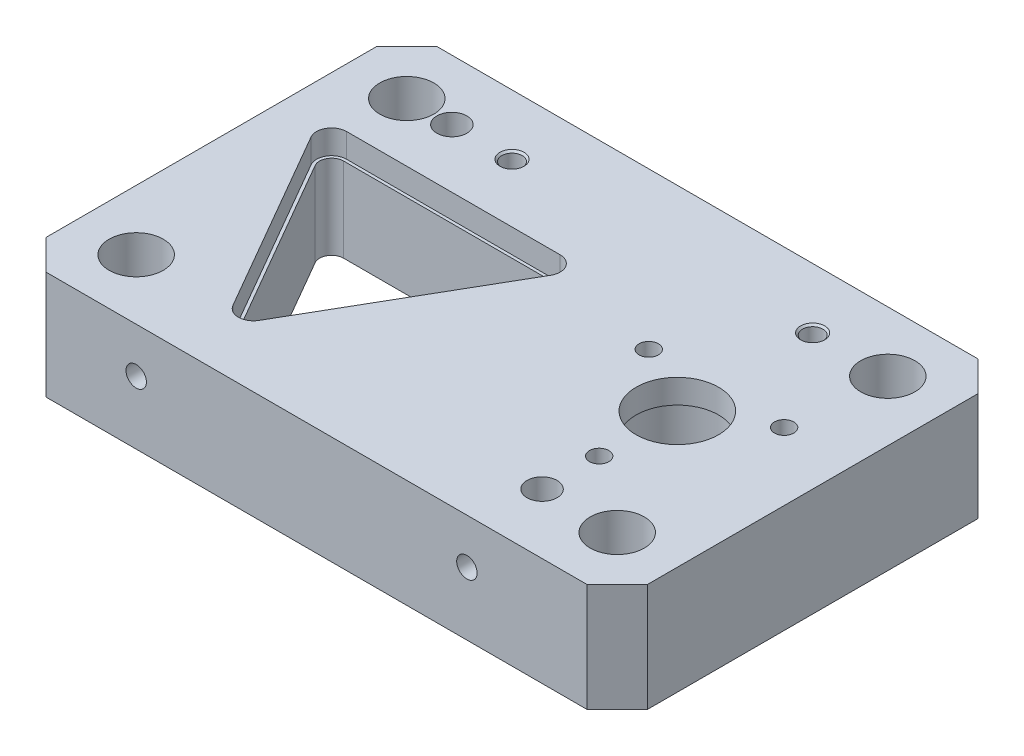
from build123d import *

# Parameters (mm, degrees)
SKETCH1_R                   = 5
SKETCH1_R_2                 = 5.5
SKETCH1_R_3                 = 3.22
SKETCH1_R_4                 = 13.72
BOSS_EXTRUDE1_DEPTH         = 36
M8_TAPPED_HOLE2_D           = 6.8
M8_TAPPED_HOLE2_CSINK_D     = 8.05
M8_TAPPED_HOLE2_CSINK_ANGLE = 90
CUT_EXTRUDE1_DEPTH          = 8
SKETCH1_4_R                 = 9
SKETCH1_4_R_2               = 5.5
CUT_EXTRUDE2_DEPTH          = 16
CUT_EXTRUDE3_START          = -8
SKETCH1_5_R                 = 14.5
SKETCH1_5_R_2               = 4
SKETCH1_5_R_3               = 3.22
CUT_EXTRUDE3_DEPTH          = 117.583305463
M8_TAPPED_HOLE1_D           = 6.8
M8_TAPPED_HOLE1_DEPTH       = 12.957073895
M8_TAPPED_HOLE1_TIP         = 2.042926105


with BuildPart() as part:
    # Sketch1 → Boss-Extrude1 (new body)
    with BuildSketch(Plane(origin=(0, 0, 0), x_dir=(1, 0, 0), z_dir=(0, 1, 0))):
        Polygon((90, -65), (100, -55), (100, 55), (90, 65), (-90, 65), (-100, 55), (-100, -55), (-90, -65), align=None)
        with Locations((55, -45)):
            Circle(SKETCH1_R, mode=Mode.SUBTRACT)
        with Locations((-65, 45)):
            Circle(SKETCH1_R, mode=Mode.SUBTRACT)
        with Locations((-80, -45)):
            Circle(SKETCH1_R_2, mode=Mode.SUBTRACT)
        with BuildLine():
            Line((-80.507041555, 24.5), (-9.492958445, 24.5))
            ThreePointArc((-9.492958445, 24.5), (-6.02885683, 22.5), (-6.02885683, 18.5))
            Line((-6.02885683, 18.5), (-41.535898385, -43))
            ThreePointArc((-41.535898385, -43), (-45, -45), (-48.464101615, -43))
            Line((-48.464101615, -43), (-83.97114317, 18.5))
            ThreePointArc((-83.97114317, 18.5), (-83.97114317, 22.5), (-80.507041555, 24.5))
        make_face(mode=Mode.SUBTRACT)
        with Locations((80, -45)):
            Circle(SKETCH1_R_2, mode=Mode.SUBTRACT)
        with Locations((55, -26)):
            Circle(SKETCH1_R_3, mode=Mode.SUBTRACT)
        with Locations((-80, 45)):
            Circle(SKETCH1_R_2, mode=Mode.SUBTRACT)
        with Locations((32.483339502, 13)):
            Circle(SKETCH1_R_3, mode=Mode.SUBTRACT)
        with Locations((55, 0)):
            Circle(SKETCH1_R_4, mode=Mode.SUBTRACT)
        with Locations((77.516660498, 13)):
            Circle(SKETCH1_R_3, mode=Mode.SUBTRACT)
        with Locations((80, 45)):
            Circle(SKETCH1_R_2, mode=Mode.SUBTRACT)
    extrude(amount=-BOSS_EXTRUDE1_DEPTH)

    # M8 Tapped Hole2 (through all)
    with Locations(Plane(origin=(0, 0, 0), x_dir=(1, 0, 0), z_dir=(0, 1, 0))):
        with Locations((-45, 45), (55, 45)):
            CounterSinkHole(M8_TAPPED_HOLE2_D / 2, M8_TAPPED_HOLE2_CSINK_D / 2, counter_sink_angle=M8_TAPPED_HOLE2_CSINK_ANGLE)

    # Sketch1<3> → Cut-Extrude1 (cut)
    with BuildSketch(Plane(origin=(0, 0, 0), x_dir=(1, 0, 0), z_dir=(0, 1, 0))):
        with BuildLine():
            ThreePointArc((-49.330127019, -43.5), (-45, -46), (-40.669872981, -43.5))
            Line((-40.669872981, -43.5), (-5.162831426, 18))
            ThreePointArc((-5.162831426, 18), (-5.162831426, 23), (-9.492958445, 25.5))
            Line((-9.492958445, 25.5), (-80.507041555, 25.5))
            ThreePointArc((-80.507041555, 25.5), (-84.837168574, 23), (-84.837168574, 18))
            Line((-84.837168574, 18), (-49.330127019, -43.5))
        make_face()
        with BuildLine():
            Line((-80.507041555, 24.5), (-9.492958445, 24.5))
            ThreePointArc((-9.492958445, 24.5), (-6.02885683, 22.5), (-6.02885683, 18.5))
            Line((-6.02885683, 18.5), (-41.535898385, -43))
            ThreePointArc((-41.535898385, -43), (-45, -45), (-48.464101615, -43))
            Line((-48.464101615, -43), (-83.97114317, 18.5))
            ThreePointArc((-83.97114317, 18.5), (-83.97114317, 22.5), (-80.507041555, 24.5))
        make_face(mode=Mode.SUBTRACT)
    extrude(amount=-CUT_EXTRUDE1_DEPTH, mode=Mode.SUBTRACT)

    # Sketch1<4> → Cut-Extrude2 (cut)
    # profile 1 of 4: a face of its own
    with BuildSketch(Plane(origin=(0, 0, 0), x_dir=(1, 0, 0), z_dir=(0, 1, 0))):
        with Locations((-80, 45)):
            Circle(SKETCH1_4_R)
        with Locations((-80, 45)):
            Circle(SKETCH1_4_R_2, mode=Mode.SUBTRACT)
    # profile 2 of 4: a face of its own
    with BuildSketch(Plane(origin=(0, 0, 0), x_dir=(1, 0, 0), z_dir=(0, 1, 0))):
        with Locations((80, 45)):
            Circle(SKETCH1_4_R)
        with Locations((80, 45)):
            Circle(SKETCH1_4_R_2, mode=Mode.SUBTRACT)
    # profile 3 of 4: a face of its own
    with BuildSketch(Plane(origin=(0, 0, 0), x_dir=(1, 0, 0), z_dir=(0, 1, 0))):
        with Locations((80, -45)):
            Circle(SKETCH1_4_R)
        with Locations((80, -45)):
            Circle(SKETCH1_4_R_2, mode=Mode.SUBTRACT)
    # profile 4 of 4: a face of its own
    with BuildSketch(Plane(origin=(0, 0, 0), x_dir=(1, 0, 0), z_dir=(0, 1, 0))):
        with Locations((-80, -45)):
            Circle(SKETCH1_4_R)
        with Locations((-80, -45)):
            Circle(SKETCH1_4_R_2, mode=Mode.SUBTRACT)
    extrude(amount=-CUT_EXTRUDE2_DEPTH, mode=Mode.SUBTRACT)

    # Sketch1<5> → Cut-Extrude3 (cut, through all)
    # profile 1 of 4: a face of its own
    with BuildSketch(Plane(origin=(0, 0, 0), x_dir=(1, 0, 0), z_dir=(0, 1, 0)).offset(CUT_EXTRUDE3_START)):
        with Locations((55, 0)):
            Circle(SKETCH1_5_R)
    # profile 2 of 4: a face of its own
    with BuildSketch(Plane(origin=(0, 0, 0), x_dir=(1, 0, 0), z_dir=(0, 1, 0)).offset(CUT_EXTRUDE3_START)):
        with Locations((77.516660498, 13)):
            Circle(SKETCH1_5_R_2)
        with Locations((77.516660498, 13)):
            Circle(SKETCH1_5_R_3, mode=Mode.SUBTRACT)
    # profile 3 of 4: a face of its own
    with BuildSketch(Plane(origin=(0, 0, 0), x_dir=(1, 0, 0), z_dir=(0, 1, 0)).offset(CUT_EXTRUDE3_START)):
        with Locations((55, -26)):
            Circle(SKETCH1_5_R_2)
        with Locations((55, -26)):
            Circle(SKETCH1_5_R_3, mode=Mode.SUBTRACT)
    # profile 4 of 4: a face of its own
    with BuildSketch(Plane(origin=(0, 0, 0), x_dir=(1, 0, 0), z_dir=(0, 1, 0)).offset(CUT_EXTRUDE3_START)):
        with Locations((32.483339502, 13)):
            Circle(SKETCH1_5_R_2)
        with Locations((32.483339502, 13)):
            Circle(SKETCH1_5_R_3, mode=Mode.SUBTRACT)
    extrude(amount=-CUT_EXTRUDE3_DEPTH, mode=Mode.SUBTRACT)

    # M8 Tapped Hole1
    with Locations(Plane.XY.offset(65)):
        with Locations((-60, -15), (50, -15)):
            Hole(M8_TAPPED_HOLE1_D / 2, depth=M8_TAPPED_HOLE1_DEPTH)
            with Locations((0, 0, -(M8_TAPPED_HOLE1_DEPTH + M8_TAPPED_HOLE1_TIP / 2))):  # 118° drill point
                Cone(0, M8_TAPPED_HOLE1_D / 2, M8_TAPPED_HOLE1_TIP, mode=Mode.SUBTRACT)


solid = part.part
